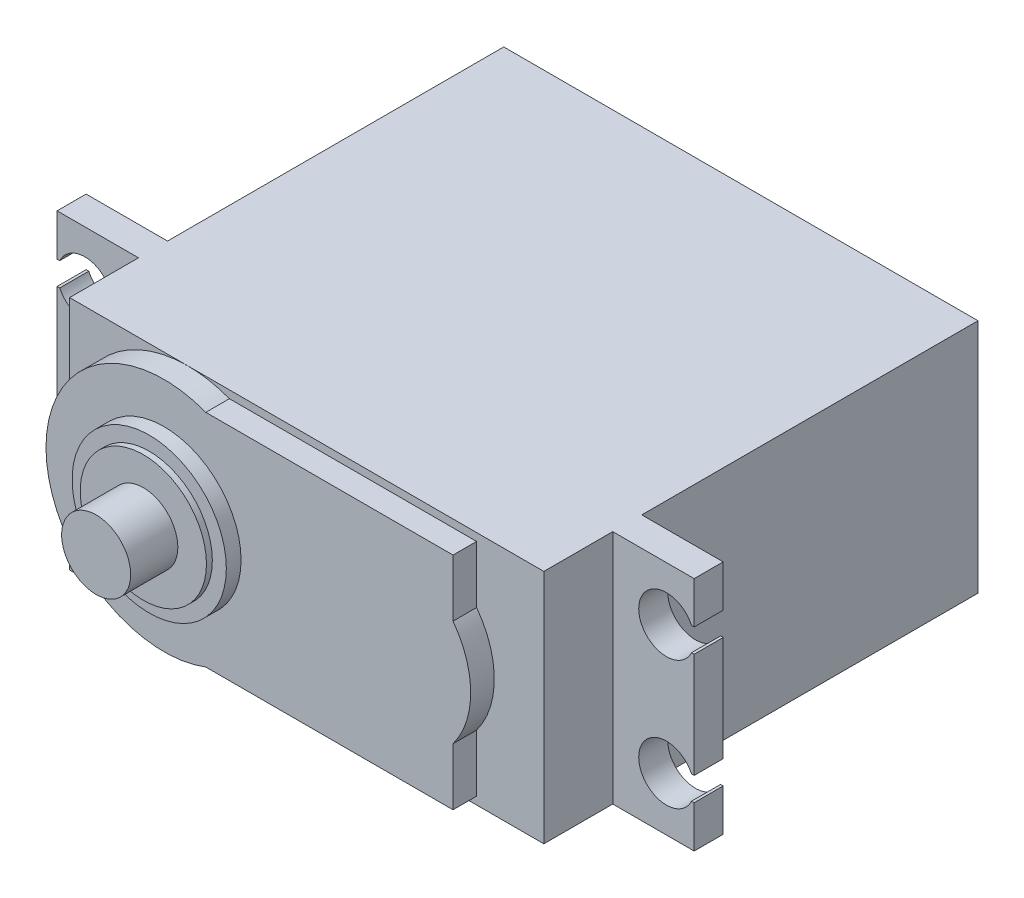
from build123d import *

# Parameters (mm, degrees)
SKIZZE1_W                       = 40.2
SKIZZE1_H                       = 36.8
AUFSATZ_LINEAR_AUSTRAGEN1_DEPTH = 20
AUFSATZ_LINEAR_AUSTRAGEN2_DEPTH = 2
SKIZZE3_R                       = 6.535
AUFSATZ_LINEAR_AUSTRAGEN3_DEPTH = 1.25
SKIZZE4_R                       = 5.35
AUFSATZ_LINEAR_AUSTRAGEN4_DEPTH = 0.5
SKIZZE5_R                       = 2.925
AUFSATZ_LINEAR_AUSTRAGEN5_DEPTH = 4
AUFSATZ_LINEAR_AUSTRAGEN6_DEPTH = 2.46


with BuildPart() as part:
    # Skizze1 → Aufsatz-Linear austragen1 (new body)
    with BuildSketch(Plane(origin=(0, 0, 0), x_dir=(1, 0, 0), z_dir=(0, 1, 0))):
        Rectangle(SKIZZE1_W, SKIZZE1_H)
    extrude(amount=AUFSATZ_LINEAR_AUSTRAGEN1_DEPTH)

    # Skizze2 → Aufsatz-Linear austragen2 (add)
    with BuildSketch(Plane.XY.offset(18.4)):
        with BuildLine():
            Line((-6.553522875, 19.35), (14.4, 19.35))
            Line((14.4, 19.35), (14.4, 14.5))
            ThreePointArc((14.4, 14.5), (15.9, 10), (14.4, 5.5))
            Line((14.4, 5.5), (14.4, 0.65))
            Line((14.4, 0.65), (-6.553522875, 0.65))
            ThreePointArc((-6.553522875, 0.65), (-20.1, 10), (-6.553522875, 19.35))
        make_face()
    extrude(amount=AUFSATZ_LINEAR_AUSTRAGEN2_DEPTH)

    # Skizze3 → Aufsatz-Linear austragen3 (add)
    with BuildSketch(Plane.XY.offset(20.4)):
        with Locations((-10.1, 10)):
            Circle(SKIZZE3_R)
    extrude(amount=AUFSATZ_LINEAR_AUSTRAGEN3_DEPTH)

    # Skizze4 → Aufsatz-Linear austragen4 (add)
    with BuildSketch(Plane.XY.offset(21.65)):
        with Locations((-10.1, 10)):
            Circle(SKIZZE4_R)
    extrude(amount=AUFSATZ_LINEAR_AUSTRAGEN4_DEPTH)

    # Skizze5 → Aufsatz-Linear austragen5 (add)
    with BuildSketch(Plane.XY.offset(22.15)):
        with Locations((-10.1, 10)):
            Circle(SKIZZE5_R)
    extrude(amount=AUFSATZ_LINEAR_AUSTRAGEN5_DEPTH)

    # Skizze6 → Aufsatz-Linear austragen6 (add)
    with BuildSketch(Plane(origin=(0, 0, 10.1), x_dir=(-1, 0, 0), z_dir=(0, 0, -1))):
        with BuildLine():
            Line((20.1, 20), (20.1, 0))
            Line((20.1, 0), (27, 0))
            Line((27, 0), (27, 3.55))
            Line((27, 3.55), (26.776617032, 3.55))
            ThreePointArc((26.776617032, 3.55), (22.3, 4.55), (26.776617032, 5.55))
            Line((26.776617032, 5.55), (27, 5.55))
            Line((27, 5.55), (27, 14.45))
            Line((27, 14.45), (26.776617032, 14.45))
            ThreePointArc((26.776617032, 14.45), (22.3, 15.45), (26.776617032, 16.45))
            Line((26.776617032, 16.45), (27, 16.45))
            Line((27, 16.45), (27, 20))
            Line((27, 20), (20.1, 20))
        make_face()
        with BuildLine():
            Line((-27, 3.55), (-27, 0))
            Line((-27, 0), (-20.1, 0))
            Line((-20.1, 0), (-20.1, 20))
            Line((-20.1, 20), (-27, 20))
            Line((-27, 20), (-27, 16.45))
            Line((-27, 16.45), (-26.776617032, 16.45))
            ThreePointArc((-26.776617032, 16.45), (-22.3, 15.45), (-26.776617032, 14.45))
            Line((-26.776617032, 14.45), (-27, 14.45))
            Line((-27, 14.45), (-27, 5.55))
            Line((-27, 5.55), (-26.776617032, 5.55))
            ThreePointArc((-26.776617032, 5.55), (-22.3, 4.55), (-26.776617032, 3.55))
            Line((-26.776617032, 3.55), (-27, 3.55))
        make_face()
    extrude(amount=-AUFSATZ_LINEAR_AUSTRAGEN6_DEPTH)


solid = part.part
